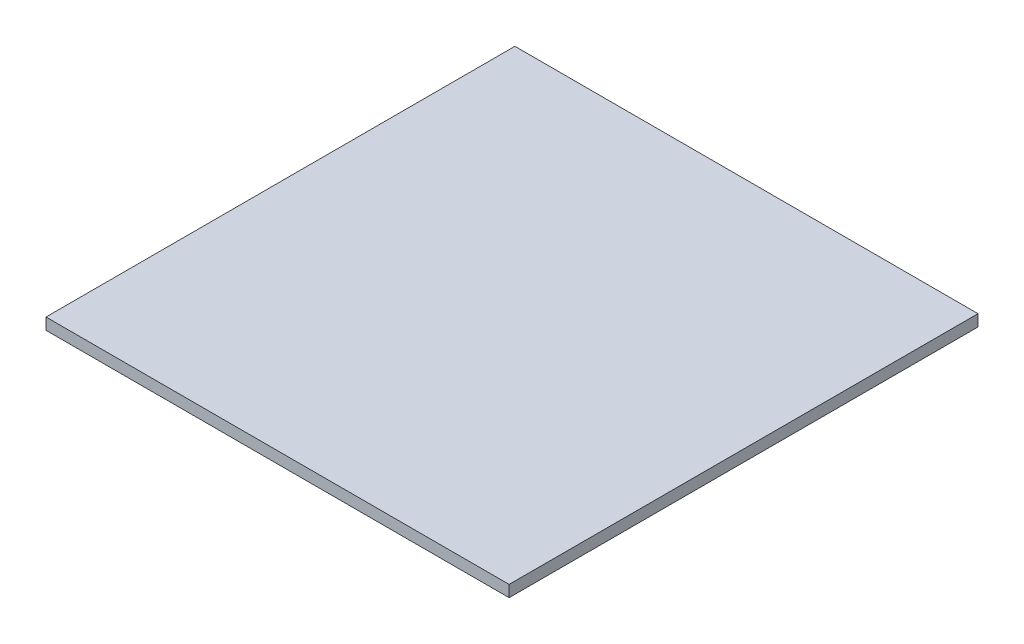
from build123d import *

# Parameters (mm, degrees)
SKETCH1_W           = 482
SKETCH1_H           = 488
BOSS_EXTRUDE1_DEPTH = 12


with BuildPart() as part:
    # Sketch1 → Boss-Extrude1 (new body)
    with BuildSketch(Plane(origin=(0, 0, 0), x_dir=(1, 0, 0), z_dir=(0, 1, 0))):
        with Locations((241, 244)):
            Rectangle(SKETCH1_W, SKETCH1_H)
    extrude(amount=BOSS_EXTRUDE1_DEPTH)


solid = part.part
